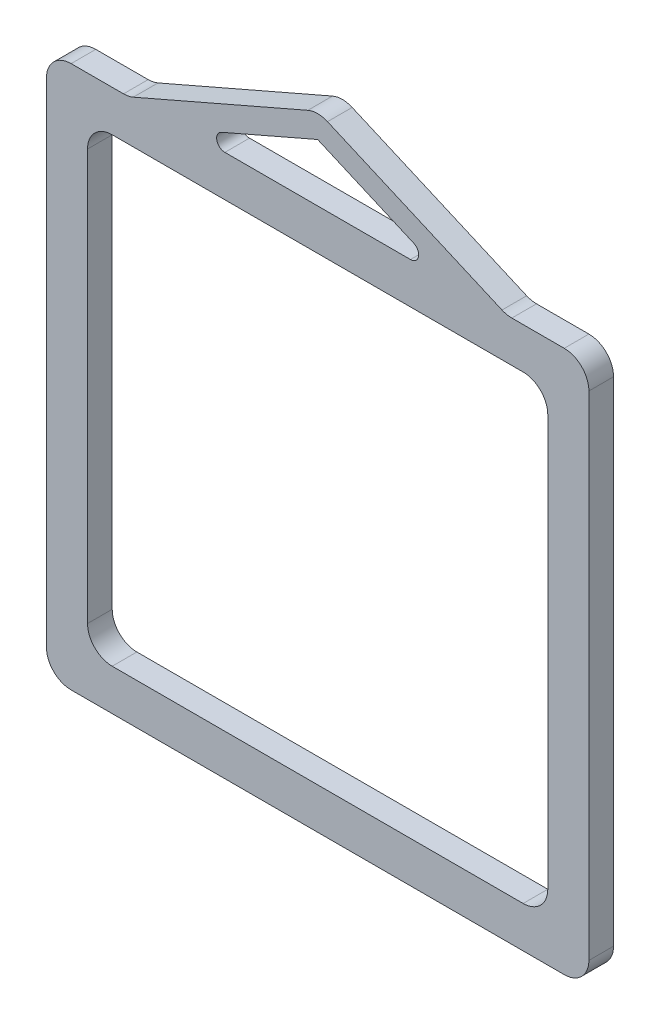
from build123d import *

# Parameters (mm, degrees)
SKETCH1_W           = 56
SKETCH1_H           = 56
BOSS_EXTRUDE1_DEPTH = 3
FILLET1_R           = 3
FILLET2_R           = 1


with BuildPart() as part:
    # Sketch1 → Boss-Extrude1 (new body)
    with BuildSketch(Plane.XY):
        Polygon((-23, 33), (0, 43), (23, 33), (33, 33), (33, -33), (-33, -33), (-33, 33), align=None)
        Rectangle(SKETCH1_W, SKETCH1_H, mode=Mode.SUBTRACT)
        Polygon((-16.1, 33), (0, 40), (16.1, 33), align=None, mode=Mode.SUBTRACT)
    extrude(amount=BOSS_EXTRUDE1_DEPTH)

    # Fillet1
    fillet1_edges = [part.edges().sort_by_distance(p)[0] for p in [
        (33, -33, 1.5),
        (-33, -33, 1.5),
        (-33, 33, 1.5),
        (-23, 33, 1.5),
        (0, 43, 1.5),
        (23, 33, 1.5),
        (33, 33, 1.5),
        (28, -28, 1.5),
        (28, 28, 1.5),
        (-28, 28, 1.5),
        (-28, -28, 1.5),
    ]]
    fillet(fillet1_edges, radius=FILLET1_R)

    # Fillet2
    fillet2_edges = [part.edges().sort_by_distance(p)[0] for p in [
        (-16.1, 33, 1.5),
        (16.1, 33, 1.5),
    ]]
    fillet(fillet2_edges, radius=FILLET2_R)


solid = part.part
